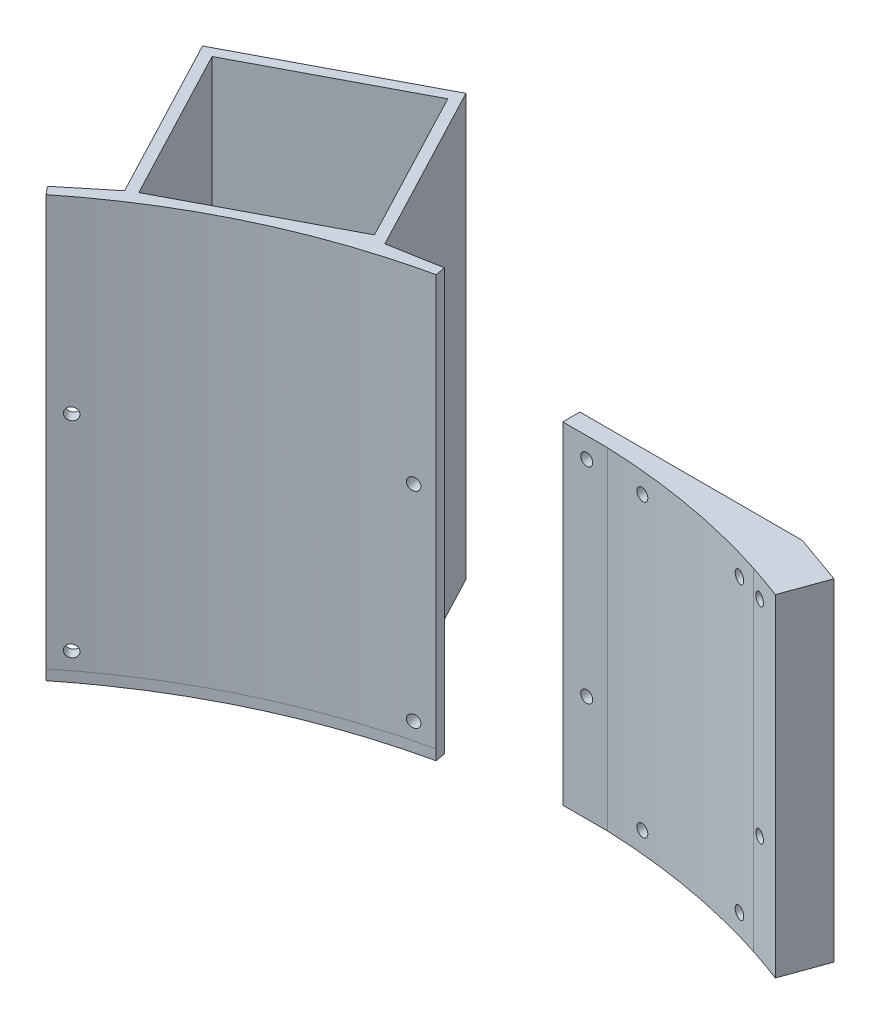
from build123d import *

# Parameters (mm, degrees)
BOSS_EXTRUDE1_DEPTH   = 120
BOSS_EXTRUDE1_2_DEPTH = 120
BOSS_EXTRUDE2_DEPTH   = 3
SKETCH4_R             = 1.75
CUT_EXTRUDE1_DEPTH    = 10
SKETCH6_R             = 1.75
CUT_EXTRUDE2_DEPTH    = 10
SKETCH7_R             = 1.75
SKETCH7_W             = 65
SKETCH7_H             = 23
CUT_EXTRUDE3_DEPTH    = 20
SKETCH8_R             = 1.75
CUT_EXTRUDE4_DEPTH    = 20


with BuildPart() as part:
    # Sketch2 → Boss-Extrude1 (new body)
    with BuildSketch(Plane(origin=(0, 0, 0), x_dir=(1, 0, 0), z_dir=(0, 1, 0))):
        with BuildLine():
            Line((-131.733475868, 206.976913464), (-106.497162739, 158.958461077))
            Line((-106.497162739, 158.958461077), (-118.893696917, 148.842832556))
            Line((-118.893696917, 148.842832556), (-116.997016569, 146.518482397))
            add(Edge.make_bspline(
                [(-116.997016569, 146.518482397), (-94.210549236, 164.644091032), (-68.45684277, 176.884970613), (-39.735897173, 183.241121138)],
                knots=[0.004465684, 0.004465684, 0.004465684, 0.004465684, 1, 1, 1, 1], degree=3))
            Line((-39.735897173, 183.241121138), (-40.26436749, 186.19420751))
            Line((-40.26436749, 186.19420751), (-55.029799353, 183.551855925))
            Line((-55.029799353, 183.551855925), (-81.277314594, 233.494375438))
            Line((-81.277314594, 233.494375438), (-131.733475868, 206.976913464))
        make_face()
        Polygon((-103.956082352, 160.571995519), (-58.81109595, 184.298145706), (-82.537246136, 229.443132109), (-127.682232539, 205.716981922), align=None, mode=Mode.SUBTRACT)
    extrude(amount=BOSS_EXTRUDE1_DEPTH)

    # Sketch5 → Boss-Extrude2 (add)
    with BuildSketch(Plane.XZ):
        with BuildLine():
            Line((-39.735897173, -183.241121138), (-40.26436749, -186.19420751))
            Line((-40.26436749, -186.19420751), (-55.029799353, -183.551855925))
            Line((-55.029799353, -183.551855925), (-81.277314594, -233.494375438))
            Line((-81.277314594, -233.494375438), (-131.733475868, -206.976913464))
            Line((-131.733475868, -206.976913464), (-106.497162739, -158.958461077))
            Line((-106.497162739, -158.958461077), (-118.893696917, -148.842832556))
            Line((-118.893696917, -148.842832556), (-116.997016569, -146.518482397))
            add(Edge.make_bspline(
                [(-116.997016569, -146.518482397), (-82.81731557, -173.70689535), (-39.735897173, -183.241121138)],
                knots=[0, 0, 0, 1, 1, 1], degree=2))
        make_face()
    extrude(amount=BOSS_EXTRUDE2_DEPTH)

    # Sketch4 → Cut-Extrude1 (cut)
    with BuildSketch(Plane(origin=(-120.432078952, 0, -147.587505787), x_dir=(-0.7747833861287918, 0, 0.6322267825541745), z_dir=(-0.6322267825541745, 0, -0.7747833861287918))):
        with Locations((-7.312447943, 5)):
            Circle(SKETCH4_R)
        with Locations((-7.312447943, 65)):
            Circle(SKETCH4_R)
    extrude(amount=-CUT_EXTRUDE1_DEPTH, mode=Mode.SUBTRACT)

    # Sketch6 → Cut-Extrude2 (cut)
    with BuildSketch(Plane(origin=(-33.535910128, 0, -187.398300296), x_dir=(-0.9843621241914816, 0, 0.17615677238537933), z_dir=(-0.1761567723853793, 0, -0.9843621241914815))):
        with Locations((12.287954794, 65)):
            Circle(SKETCH6_R)
        with Locations((12.287954794, 5)):
            Circle(SKETCH6_R)
    extrude(amount=-CUT_EXTRUDE2_DEPTH, mode=Mode.SUBTRACT)


with BuildPart() as body_2:
    # Sketch2 → Boss-Extrude1 2 (new body)
    with BuildSketch(Plane(origin=(0, 0, 0), x_dir=(1, 0, 0), z_dir=(0, 1, 0))):
        with BuildLine():
            Line((7.497222042, 192.5), (58, 192.5))
            Line((58, 192.5), (72.130758111, 187.482989601))
            Line((72.130758111, 187.482989601), (72.329757157, 187.411039321))
            Line((72.329757157, 187.411039321), (67.777738536, 174.8211319))
            add(Edge.make_bspline(
                [(58, 178.303813756), (62.937238269, 176.697757749), (67.777738536, 174.8211319)],
                knots=[0, 0, 0, 1, 1, 1], degree=2))
            add(Edge.make_bspline(
                [(6, 187.5), (32.674168427, 186.491531402), (58, 178.303813756)],
                knots=[0, 0, 0, 1, 1, 1], degree=2))
            Line((6, 187.5), (-7, 187.5))
            Line((-7, 187.5), (-7, 192.5))
            Line((-7, 192.5), (7.497222042, 192.5))
        make_face()
    extrude(amount=BOSS_EXTRUDE1_2_DEPTH)

    # Sketch7 → Cut-Extrude3 (cut)
    with BuildSketch(Plane(origin=(0, 0, -192.5), x_dir=(-1, 0, 0), z_dir=(0, 0, -1))):
        with Locations((-17, 6)):
            Circle(SKETCH7_R)
        with Locations((-52, 6)):
            Circle(SKETCH7_R)
        with Locations((-17, 91)):
            Circle(SKETCH7_R)
        with Locations((-52, 91)):
            Circle(SKETCH7_R)
        with Locations((0, 31)):
            Circle(SKETCH7_R)
        with Locations((0, 91)):
            Circle(SKETCH7_R)
        with Locations((-25.5, 108.5)):
            Rectangle(SKETCH7_W, SKETCH7_H)
    extrude(amount=-CUT_EXTRUDE3_DEPTH, mode=Mode.SUBTRACT)

    # Sketch8 → Cut-Extrude4 (cut)
    with BuildSketch(Plane(origin=(67.187435243, 0, -189.238076061), x_dir=(-0.9423674008829427, 0, -0.33457985855865147), z_dir=(0.33457985855865147, 0, -0.9423674008829428))):
        with Locations((2.249313521, 31)):
            Circle(SKETCH8_R)
        with Locations((2.249313521, 91)):
            Circle(SKETCH8_R)
        Polygon((9.749313521, 97), (-5.245642901, 97), (-14.139279105, 97), (-14.139279105, 120), (-5.245642901, 120), (9.749313521, 120), align=None)
    extrude(amount=-CUT_EXTRUDE4_DEPTH, mode=Mode.SUBTRACT)


solid = Compound([part.part, body_2.part])
